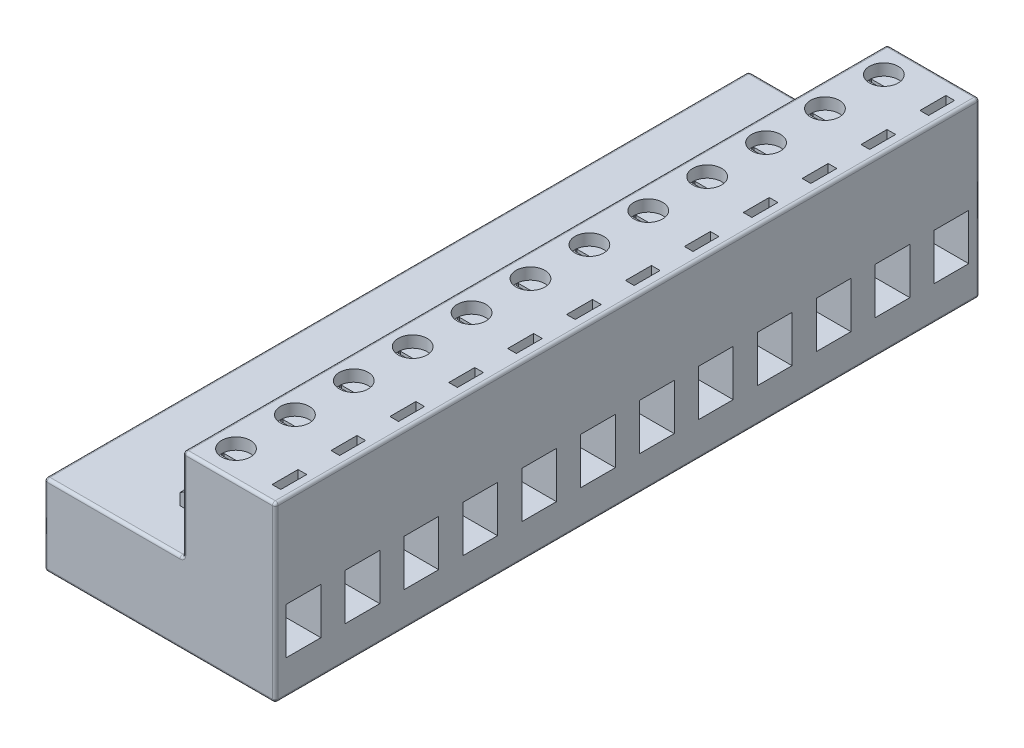
from build123d import *
from OCP.BRepFilletAPI import BRepFilletAPI_MakeChamfer

# Parameters (mm, degrees)
SKETCH1_W           = 8
SKETCH1_H           = 15
SKETCH1_W_2         = 12
SKETCH1_H_2         = 7
BOSS_EXTRUDE1_DEPTH = 30.5
SKETCH2_W           = 3
SKETCH2_H           = 4
CUT_EXTRUDE1_DEPTH  = 6
SKETCH3_R           = 1.25
CUT_EXTRUDE2_DEPTH  = 1
SKETCH4_W           = 0.75
SKETCH4_H           = 2.25
CUT_EXTRUDE3_DEPTH  = 2
SKETCH5_W           = 0.95
SKETCH5_H           = 2.15
BOSS_EXTRUDE2_DEPTH = 4
CHAMFER1_SIZE       = 2
CHAMFER1_SIZE2      = 1.154700538
SKETCH6_W           = 2.35
SKETCH6_H           = 0.25
CUT_EXTRUDE4_DEPTH  = 0.25
FILLET1_R           = 0.25


with BuildPart() as part:
    # Sketch1 → Boss-Extrude1 (new, symmetric)
    with BuildSketch(Plane.XY):
        Rectangle(SKETCH1_W, SKETCH1_H)
        with Locations((-10, -4)):
            Rectangle(SKETCH1_W_2, SKETCH1_H_2)
    extrude(amount=BOSS_EXTRUDE1_DEPTH, both=True)

    # Sketch2 → Cut-Extrude1 (cut)
    with BuildSketch(Plane(origin=(4, 0, 0), x_dir=(0, 0, -1), z_dir=(1, 0, 0))):
        with Locations((-28.05, -2.5)):
            Rectangle(SKETCH2_W, SKETCH2_H)
        with Locations((-22.95, -2.5)):
            Rectangle(SKETCH2_W, SKETCH2_H)
        with Locations((-17.85, -2.5)):
            Rectangle(SKETCH2_W, SKETCH2_H)
        with Locations((-12.75, -2.5)):
            Rectangle(SKETCH2_W, SKETCH2_H)
        with Locations((-7.65, -2.5)):
            Rectangle(SKETCH2_W, SKETCH2_H)
        with Locations((-2.55, -2.5)):
            Rectangle(SKETCH2_W, SKETCH2_H)
        with Locations((2.55, -2.5)):
            Rectangle(SKETCH2_W, SKETCH2_H)
        with Locations((7.65, -2.5)):
            Rectangle(SKETCH2_W, SKETCH2_H)
        with Locations((12.75, -2.5)):
            Rectangle(SKETCH2_W, SKETCH2_H)
        with Locations((17.85, -2.5)):
            Rectangle(SKETCH2_W, SKETCH2_H)
        with Locations((22.95, -2.5)):
            Rectangle(SKETCH2_W, SKETCH2_H)
        with Locations((28.05, -2.5)):
            Rectangle(SKETCH2_W, SKETCH2_H)
    extrude(amount=-CUT_EXTRUDE1_DEPTH, mode=Mode.SUBTRACT)

    # Sketch3 → Cut-Extrude2 (cut)
    with BuildSketch(Plane(origin=(0, 7.5, 0), x_dir=(1, 0, 0), z_dir=(0, 1, 0))):
        with Locations(Location((-1.85, -28.05, 0), (0, 0, 270))):
            Circle(SKETCH3_R)
        with Locations(Location((-1.85, -22.95, 0), (0, 0, 270))):
            Circle(SKETCH3_R)
        with Locations(Location((-1.85, -17.85, 0), (0, 0, 270))):
            Circle(SKETCH3_R)
        with Locations(Location((-1.85, -12.75, 0), (0, 0, 270))):
            Circle(SKETCH3_R)
        with Locations(Location((-1.85, -7.65, 0), (0, 0, 270))):
            Circle(SKETCH3_R)
        with Locations(Location((-1.85, -2.55, 0), (0, 0, 270))):
            Circle(SKETCH3_R)
        with Locations(Location((-1.85, 2.55, 0), (0, 0, 270))):
            Circle(SKETCH3_R)
        with Locations(Location((-1.85, 7.65, 0), (0, 0, 270))):
            Circle(SKETCH3_R)
        with Locations(Location((-1.85, 12.75, 0), (0, 0, 270))):
            Circle(SKETCH3_R)
        with Locations(Location((-1.85, 17.85, 0), (0, 0, 270))):
            Circle(SKETCH3_R)
        with Locations(Location((-1.85, 22.95, 0), (0, 0, 270))):
            Circle(SKETCH3_R)
        with Locations(Location((-1.85, 28.05, 0), (0, 0, 270))):
            Circle(SKETCH3_R)
    extrude(amount=-CUT_EXTRUDE2_DEPTH, mode=Mode.SUBTRACT)

    # Sketch4 → Cut-Extrude3 (cut)
    with BuildSketch(Plane(origin=(0, 7.5, 0), x_dir=(1, 0, 0), z_dir=(0, 1, 0))):
        with Locations((2.775, -28.05)):
            Rectangle(SKETCH4_W, SKETCH4_H)
        with Locations((2.775, -22.95)):
            Rectangle(SKETCH4_W, SKETCH4_H)
        with Locations((2.775, -17.85)):
            Rectangle(SKETCH4_W, SKETCH4_H)
        with Locations((2.775, -12.75)):
            Rectangle(SKETCH4_W, SKETCH4_H)
        with Locations((2.775, -7.65)):
            Rectangle(SKETCH4_W, SKETCH4_H)
        with Locations((2.775, -2.55)):
            Rectangle(SKETCH4_W, SKETCH4_H)
        with Locations((2.775, 2.55)):
            Rectangle(SKETCH4_W, SKETCH4_H)
        with Locations((2.775, 7.65)):
            Rectangle(SKETCH4_W, SKETCH4_H)
        with Locations((2.775, 12.75)):
            Rectangle(SKETCH4_W, SKETCH4_H)
        with Locations((2.775, 17.85)):
            Rectangle(SKETCH4_W, SKETCH4_H)
        with Locations((2.775, 22.95)):
            Rectangle(SKETCH4_W, SKETCH4_H)
        with Locations((2.775, 28.05)):
            Rectangle(SKETCH4_W, SKETCH4_H)
    extrude(amount=-CUT_EXTRUDE3_DEPTH, mode=Mode.SUBTRACT)

    # Sketch5 → Boss-Extrude2 (add)
    with BuildSketch(Plane.ZY.offset(4)):
        with Locations((-26.275, 0.575)):
            Rectangle(SKETCH5_W, SKETCH5_H)
        with Locations((-2.503825024, 0.575)):
            Rectangle(SKETCH5_W, SKETCH5_H)
        with Locations((2.503825024, 0.575)):
            Rectangle(SKETCH5_W, SKETCH5_H)
        with Locations((26.275, 0.575)):
            Rectangle(SKETCH5_W, SKETCH5_H)
    extrude(amount=BOSS_EXTRUDE2_DEPTH)

    # Chamfer1: one chamfer whose edges measure the first distance from different faces: ONE call of the kernel's chamfer builder (chamfer() names one face for all edges)
    chamfer1_edges_1 = [part.edges().sort_by_distance(p)[0] for p in [
        (-8, 1.65, -26.275),
    ]]
    chamfer1_side_1 = [part.faces().sort_by_distance(p)[0] for p in [
        (-6, 1.65, -26.275),
    ]]
    chamfer1_edges_2 = [part.edges().sort_by_distance(p)[0] for p in [
        (-8, 1.65, -2.503825024),
    ]]
    chamfer1_side_2 = [part.faces().sort_by_distance(p)[0] for p in [
        (-6, 1.65, -2.503825024),
    ]]
    chamfer1_edges_3 = [part.edges().sort_by_distance(p)[0] for p in [
        (-8, 1.65, 2.503825024),
    ]]
    chamfer1_side_3 = [part.faces().sort_by_distance(p)[0] for p in [
        (-6, 1.65, 2.503825024),
    ]]
    chamfer1_edges_4 = [part.edges().sort_by_distance(p)[0] for p in [
        (-8, 1.65, 26.275),
    ]]
    chamfer1_side_4 = [part.faces().sort_by_distance(p)[0] for p in [
        (-6, 1.65, 26.275),
    ]]
    chamfer1 = BRepFilletAPI_MakeChamfer(part.part.solid().wrapped)
    for e in chamfer1_edges_1:
        chamfer1.Add(CHAMFER1_SIZE, CHAMFER1_SIZE2, e.wrapped, chamfer1_side_1[0].wrapped)  # the first distance lies on this face
    for e in chamfer1_edges_2:
        chamfer1.Add(CHAMFER1_SIZE, CHAMFER1_SIZE2, e.wrapped, chamfer1_side_2[0].wrapped)  # the first distance lies on this face
    for e in chamfer1_edges_3:
        chamfer1.Add(CHAMFER1_SIZE, CHAMFER1_SIZE2, e.wrapped, chamfer1_side_3[0].wrapped)  # the first distance lies on this face
    for e in chamfer1_edges_4:
        chamfer1.Add(CHAMFER1_SIZE, CHAMFER1_SIZE2, e.wrapped, chamfer1_side_4[0].wrapped)  # the first distance lies on this face
    add(Compound.cast(chamfer1.Shape()), mode=Mode.REPLACE)

    # Sketch6 → Cut-Extrude4 (cut)
    with BuildSketch(Plane(origin=(0, 6.5, 0), x_dir=(1, 0, 0), z_dir=(0, 1, 0))):
        with Locations((-1.85, -22.95)):
            Rectangle(SKETCH6_W, SKETCH6_H)
        with Locations((-1.85, -28.05)):
            Rectangle(SKETCH6_W, SKETCH6_H)
        with Locations((-1.85, -17.85)):
            Rectangle(SKETCH6_W, SKETCH6_H)
        with Locations((-1.85, -12.75)):
            Rectangle(SKETCH6_W, SKETCH6_H)
        with Locations((-1.85, -7.65)):
            Rectangle(SKETCH6_W, SKETCH6_H)
        with Locations((-1.85, -2.55)):
            Rectangle(SKETCH6_W, SKETCH6_H)
        with Locations((-1.85, 2.55)):
            Rectangle(SKETCH6_W, SKETCH6_H)
        with Locations((-1.85, 7.65)):
            Rectangle(SKETCH6_W, SKETCH6_H)
        with Locations((-1.85, 12.75)):
            Rectangle(SKETCH6_W, SKETCH6_H)
        with Locations((-1.85, 17.85)):
            Rectangle(SKETCH6_W, SKETCH6_H)
        with Locations((-1.85, 22.95)):
            Rectangle(SKETCH6_W, SKETCH6_H)
        with Locations((-1.85, 28.05)):
            Rectangle(SKETCH6_W, SKETCH6_H)
    extrude(amount=-CUT_EXTRUDE4_DEPTH, mode=Mode.SUBTRACT)

    # Fillet1
    fillet1_edges = [part.edges().sort_by_distance(p)[0] for p in [
        (-6, -7.5, -30.5),
        (4, 0, 30.5),
        (-16, -7.5, 0),
        (-16, -0.5, 0),
        (-4, -0.5, 28.625),
        (-4, 7.5, 0),
        (4, 7.5, 0),
        (4, -7.5, 0),
        (0, 7.5, 30.5),
        (-4, 3.5, 30.5),
        (-10, -0.5, 30.5),
        (-16, -4, 30.5),
        (-4, -0.5, -28.625),
        (-4, -0.5, -14.389412512),
        (-4, -0.5, 0),
        (-4, -0.5, 14.389412512),
        (-6, -7.5, 30.5),
        (-16, -4, -30.5),
        (-10, -0.5, -30.5),
        (-4, 3.5, -30.5),
        (0, 7.5, -30.5),
        (4, 0, -30.5),
    ]]
    fillet(fillet1_edges, radius=FILLET1_R)


solid = part.part
